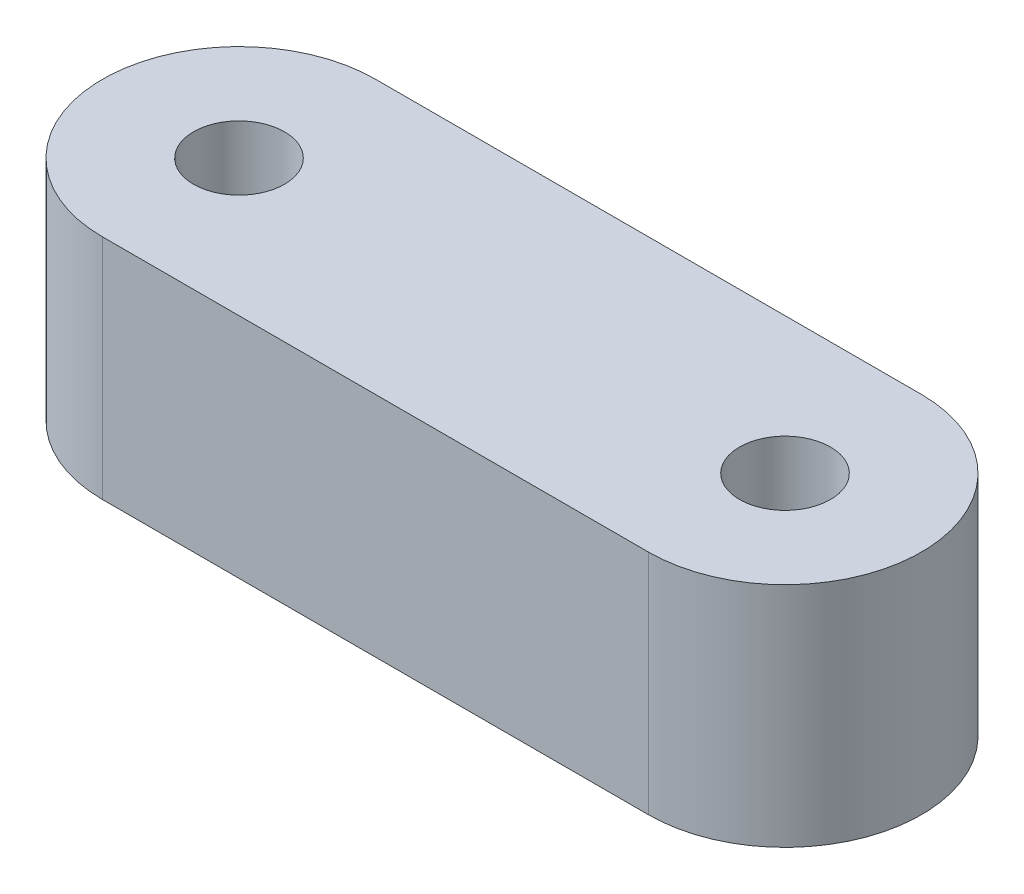
from build123d import *

# Parameters (mm, degrees)
BOSS_EXTRUDE1_DEPTH = 12.7
SKETCH4_R           = 2.54
CUT_EXTRUDE3_DEPTH  = 61.26815743


with BuildPart() as part:
    # Sketch3 → Boss-Extrude1 (new body)
    with BuildSketch(Plane(origin=(0, 0, 0), x_dir=(1, 0, 0), z_dir=(0, 1, 0))):
        with BuildLine():
            Line((-50.8, 7.62), (-20.32, 7.62))
            ThreePointArc((-20.32, 7.62), (-12.7, 0), (-20.32, -7.62))
            Line((-20.32, -7.62), (-50.8, -7.62))
            ThreePointArc((-50.8, -7.62), (-58.42, 0), (-50.8, 7.62))
        make_face()
    extrude(amount=BOSS_EXTRUDE1_DEPTH)

    # Sketch4 → Cut-Extrude3 (cut, through all)
    with BuildSketch(Plane(origin=(0, 12.7, 0), x_dir=(1, 0, 0), z_dir=(0, 1, 0))):
        with Locations(Location((-50.8, 0, 0), (0, 0, 270))):
            Circle(SKETCH4_R)
        with Locations(Location((-20.32, 0, 0), (0, 0, 90))):
            Circle(SKETCH4_R)
    extrude(amount=-CUT_EXTRUDE3_DEPTH, mode=Mode.SUBTRACT)


solid = part.part
